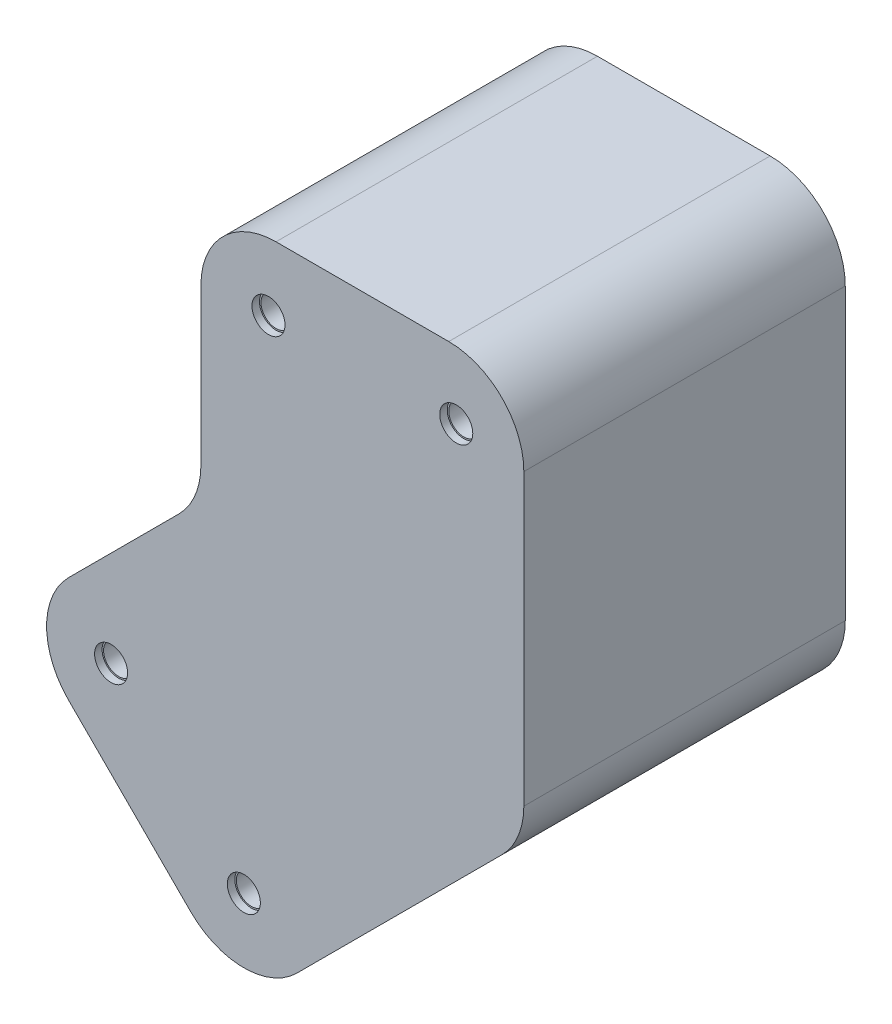
from build123d import *

# Parameters (mm, degrees)
BOSS_EXTRUDE1_DEPTH                          = 42.8
CBORE_FOR_M5_HEX_HEAD_CAP_SCREW1_D           = 4
CBORE_FOR_M5_HEX_HEAD_CAP_SCREW1_DEPTH       = 5.5
CBORE_FOR_M5_HEX_HEAD_CAP_SCREW1_CBORE_D     = 4.4
CBORE_FOR_M5_HEX_HEAD_CAP_SCREW1_CBORE_DEPTH = 1
CBORE_FOR_M5_HEX_HEAD_CAP_SCREW1_TIP         = 1.201721238
CBORE_FOR_M5_HEX_HEAD_CAP_SCREW2_D           = 4
CBORE_FOR_M5_HEX_HEAD_CAP_SCREW2_DEPTH       = 5.5
CBORE_FOR_M5_HEX_HEAD_CAP_SCREW2_CBORE_D     = 4.4
CBORE_FOR_M5_HEX_HEAD_CAP_SCREW2_CBORE_DEPTH = 1
CBORE_FOR_M5_HEX_HEAD_CAP_SCREW2_TIP         = 1.201721238
FILLET1_R                                    = 10


with BuildPart() as part:
    # Sketch3 → Boss-Extrude1 (new body)
    with BuildSketch(Plane.XY):
        Polygon((52.494949366, 117.817279836), (52.494949366, 82.900540957), (27.805086528, 58.210678119), (58.210678119, 27.805086528), (95.494949366, 65.089357775), (95.494949366, 117.817279836), align=None)
    extrude(amount=BOSS_EXTRUDE1_DEPTH)

    # CBORE for M5 Hex Head Cap Screw1
    with Locations(Plane(origin=(0, 0, 0), x_dir=(-1, 0, 0), z_dir=(0, 0, -1))):
        with Locations((-86.494949366, 108.817279836), (-61.494949366, 108.817279836), (-58.210678119, 40.533008589), (-40.533008589, 58.210678119)):
            CounterBoreHole(CBORE_FOR_M5_HEX_HEAD_CAP_SCREW1_D / 2, CBORE_FOR_M5_HEX_HEAD_CAP_SCREW1_CBORE_D / 2, CBORE_FOR_M5_HEX_HEAD_CAP_SCREW1_CBORE_DEPTH, depth=CBORE_FOR_M5_HEX_HEAD_CAP_SCREW1_DEPTH)
            with Locations((0, 0, -(CBORE_FOR_M5_HEX_HEAD_CAP_SCREW1_DEPTH + CBORE_FOR_M5_HEX_HEAD_CAP_SCREW1_TIP / 2))):  # 118° drill point
                Cone(0, CBORE_FOR_M5_HEX_HEAD_CAP_SCREW1_D / 2, CBORE_FOR_M5_HEX_HEAD_CAP_SCREW1_TIP, mode=Mode.SUBTRACT)

    # CBORE for M5 Hex Head Cap Screw2
    with Locations(Plane.XY.offset(42.8)):
        with Locations((61.494949366, 108.817279836), (86.494949366, 108.817279836), (58.210678119, 40.533008589), (40.533008589, 58.210678119)):
            CounterBoreHole(CBORE_FOR_M5_HEX_HEAD_CAP_SCREW2_D / 2, CBORE_FOR_M5_HEX_HEAD_CAP_SCREW2_CBORE_D / 2, CBORE_FOR_M5_HEX_HEAD_CAP_SCREW2_CBORE_DEPTH, depth=CBORE_FOR_M5_HEX_HEAD_CAP_SCREW2_DEPTH)
            with Locations((0, 0, -(CBORE_FOR_M5_HEX_HEAD_CAP_SCREW2_DEPTH + CBORE_FOR_M5_HEX_HEAD_CAP_SCREW2_TIP / 2))):  # 118° drill point
                Cone(0, CBORE_FOR_M5_HEX_HEAD_CAP_SCREW2_D / 2, CBORE_FOR_M5_HEX_HEAD_CAP_SCREW2_TIP, mode=Mode.SUBTRACT)

    # Fillet1
    fillet1_edges = [part.edges().sort_by_distance(p)[0] for p in [
        (95.494949366, 117.817279836, 21.4),
        (95.494949366, 65.089357775, 21.4),
        (58.210678119, 27.805086528, 21.4),
        (27.805086528, 58.210678119, 21.4),
        (52.494949366, 82.900540957, 21.4),
        (52.494949366, 117.817279836, 21.4),
    ]]
    fillet(fillet1_edges, radius=FILLET1_R)


solid = part.part
